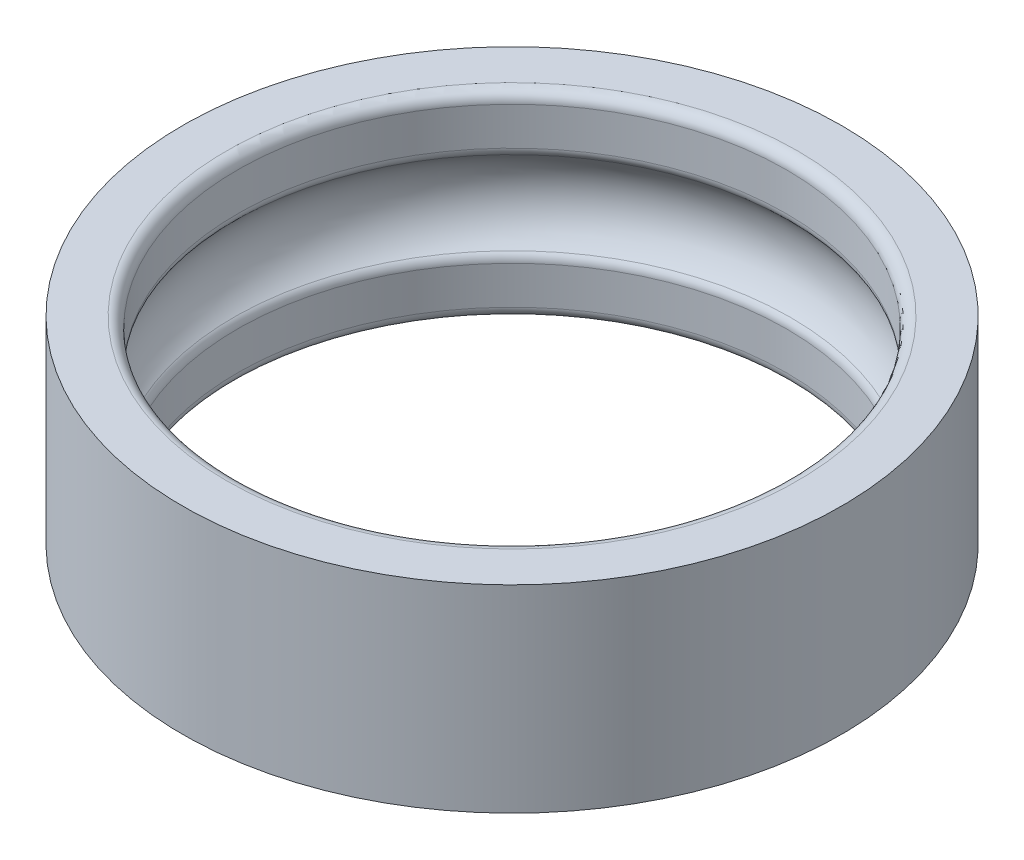
from build123d import *

# Parameters (mm, degrees)
SCALE1_SCALE = 0.266666667


with BuildPart() as part:
    # Sketch1 → Revolve1 (revolve)
    with BuildSketch(Plane(origin=(0, 0, 0), x_dir=(0, 0, -1), z_dir=(1, 0, 0))):
        with BuildLine():
            Line((25, -8), (25, -4.538997687))
            ThreePointArc((25, -4.538997687), (25.088639197, -4.127389271), (25.338842975, -3.788750135))
            ThreePointArc((25.338842975, -3.788750135), (27.05, 0), (25.338842975, 3.788750135))
            ThreePointArc((25.338842975, 3.788750135), (25.088639197, 4.127389271), (25, 4.538997687))
            Line((25, 4.538997687), (25, 8))
            ThreePointArc((25, 8), (25.292893219, 8.707106781), (26, 9))
            Line((26, 9), (30, 9))
            Line((30, 9), (30, -9))
            Line((30, -9), (26, -9))
            ThreePointArc((26, -9), (25.292893219, -8.707106781), (25, -8))
        make_face()
    revolve(axis=Axis((0, 0, 0), (0, 1, 0)))


with BuildPart() as part_1:
    # Scale1: scaled about (0, 0, 0)
    add(part.part.scale(SCALE1_SCALE))


solid = part_1.part
